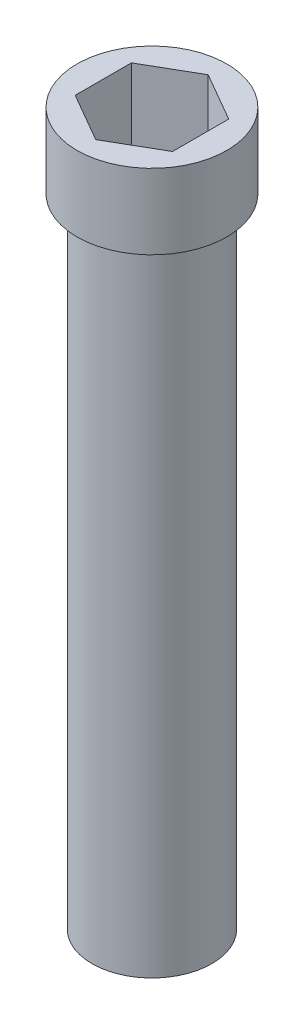
from build123d import *

# Parameters (mm, degrees)
SKETCH1_R    = 1.6
LENGTH_DEPTH = 17
SKETCH2_R    = 2
CAP_DEPTH    = 2
HEX_2_DEPTH  = 2


with BuildPart() as part:
    # Sketch1 → Length (new body)
    with BuildSketch(Plane(origin=(0, 0, 0), x_dir=(1, 0, 0), z_dir=(0, 1, 0))):
        with Locations(Location((0, 0, 0), (0, 0, 270))):
            Circle(SKETCH1_R)
    extrude(amount=LENGTH_DEPTH)

    # Sketch2 → Cap (add)
    with BuildSketch(Plane(origin=(0, 17, 0), x_dir=(1, 0, 0), z_dir=(0, 1, 0))):
        with Locations(Location((0, 0, 0), (0, 0, 270))):
            Circle(SKETCH2_R)
    extrude(amount=CAP_DEPTH)

    # Sketch3 → Hex 2 (cut)
    with BuildSketch(Plane(origin=(0, 19, 0), x_dir=(1, 0, 0), z_dir=(0, 1, 0))):
        Polygon((0, 1.5), (-1.299038106, 0.75), (-1.299038106, -0.75), (0, -1.5), (1.299038106, -0.75), (1.299038106, 0.75), align=None)
    extrude(amount=-HEX_2_DEPTH, mode=Mode.SUBTRACT)


solid = part.part
